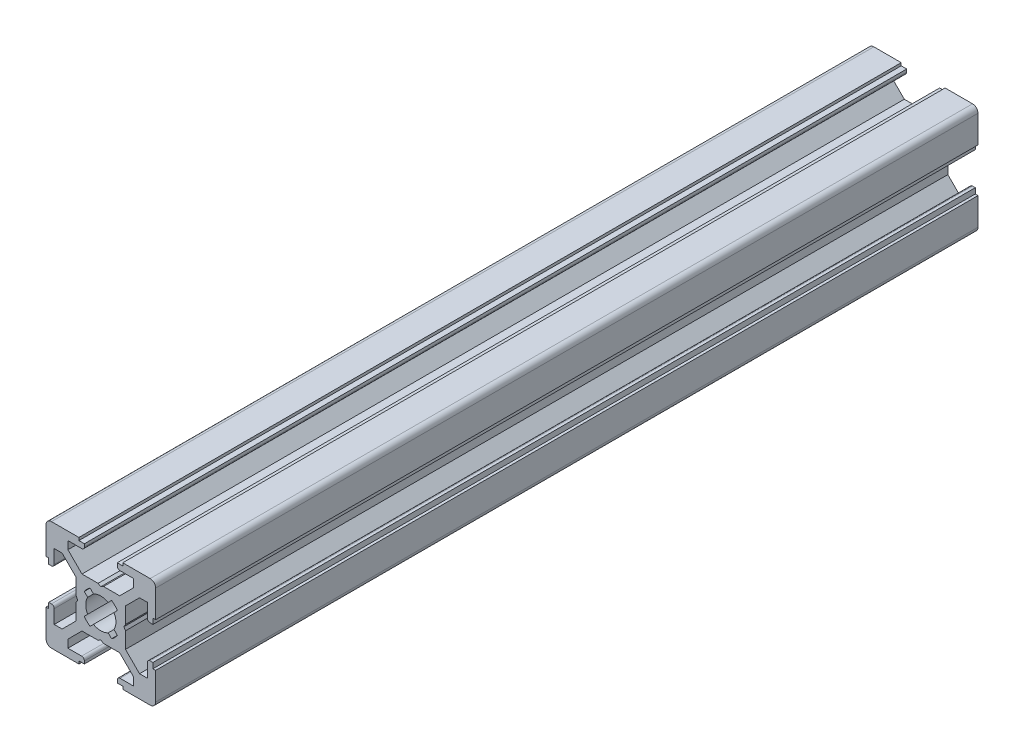
from build123d import *

# Parameters (mm, degrees)
EXTRUDE_1_DEPTH = 150


with BuildPart() as part:
    # Эскиз1 → Бобышка-Вытянуть1 (new body)
    with BuildSketch(Plane.XY):
        with BuildLine():
            Line((1, 20), (6, 20))
            Line((6, 20), (6, 19.5))
            Line((6, 19.5), (7, 19.5))
            Line((7, 19.5), (7, 19))
            ThreePointArc((7, 19), (6.853553391, 18.646446609), (6.5, 18.5))
            Line((6.5, 18.5), (4, 18.5))
            Line((4, 18.5), (4, 17.060660172))
            Line((4, 17.060660172), (6.560660172, 14.5))
            Line((6.560660172, 14.5), (9.5, 14.5))
            Line((9.5, 14.5), (10, 14.211324865))
            Line((10, 14.211324865), (10.5, 14.5))
            Line((10.5, 14.5), (13.439339828, 14.5))
            Line((13.439339828, 14.5), (16, 17.060660172))
            Line((16, 17.060660172), (16, 18.5))
            Line((16, 18.5), (13.5, 18.5))
            ThreePointArc((13.5, 18.5), (13.146446609, 18.646446609), (13, 19))
            Line((13, 19), (13, 19.5))
            Line((13, 19.5), (14, 19.5))
            Line((14, 19.5), (14, 20))
            Line((14, 20), (19, 20))
            ThreePointArc((19, 20), (19.707106781, 19.707106781), (20, 19))
            Line((20, 19), (20, 14))
            Line((20, 14), (19.5, 14))
            Line((19.5, 14), (19.5, 13))
            Line((19.5, 13), (19, 13))
            ThreePointArc((19, 13), (18.646446609, 13.146446609), (18.5, 13.5))
            Line((18.5, 13.5), (18.5, 16))
            Line((18.5, 16), (17.060660172, 16))
            Line((17.060660172, 16), (14.5, 13.439339828))
            Line((14.5, 13.439339828), (14.5, 10.5))
            Line((14.5, 10.5), (14.211324865, 10))
            Line((14.211324865, 10), (14.5, 9.5))
            Line((14.5, 9.5), (14.5, 6.560660172))
            Line((14.5, 6.560660172), (17.060660172, 4))
            Line((17.060660172, 4), (18.5, 4))
            Line((18.5, 4), (18.5, 6.5))
            ThreePointArc((18.5, 6.5), (18.646446609, 6.853553391), (19, 7))
            Line((19, 7), (19.5, 7))
            Line((19.5, 7), (19.5, 6))
            Line((19.5, 6), (20, 6))
            Line((20, 6), (20, 1))
            ThreePointArc((20, 1), (19.707106781, 0.292893219), (19, 0))
            Line((19, 0), (14, 0))
            Line((14, 0), (14, 0.5))
            Line((14, 0.5), (13, 0.5))
            Line((13, 0.5), (13, 1))
            ThreePointArc((13, 1), (13.146446609, 1.353553391), (13.5, 1.5))
            Line((13.5, 1.5), (16, 1.5))
            Line((16, 1.5), (16, 2.939339828))
            Line((16, 2.939339828), (13.439339828, 5.5))
            Line((13.439339828, 5.5), (10.5, 5.5))
            Line((10.5, 5.5), (10, 5.788675135))
            Line((10, 5.788675135), (9.5, 5.5))
            Line((9.5, 5.5), (6.560660172, 5.5))
            Line((6.560660172, 5.5), (4, 2.939339828))
            Line((4, 2.939339828), (4, 1.5))
            Line((4, 1.5), (6.5, 1.5))
            ThreePointArc((6.5, 1.5), (6.853553391, 1.353553391), (7, 1))
            Line((7, 1), (7, 0.5))
            Line((7, 0.5), (6, 0.5))
            Line((6, 0.5), (6, 0))
            Line((6, 0), (1, 0))
            ThreePointArc((1, 0), (0.292893219, 0.292893219), (0, 1))
            Line((0, 1), (0, 6))
            Line((0, 6), (0.5, 6))
            Line((0.5, 6), (0.5, 7))
            Line((0.5, 7), (1, 7))
            ThreePointArc((1, 7), (1.353553391, 6.853553391), (1.5, 6.5))
            Line((1.5, 6.5), (1.5, 4))
            Line((1.5, 4), (2.939339828, 4))
            Line((2.939339828, 4), (5.5, 6.560660172))
            Line((5.5, 6.560660172), (5.5, 9.5))
            Line((5.5, 9.5), (5.788675135, 10))
            Line((5.788675135, 10), (5.5, 10.5))
            Line((5.5, 10.5), (5.5, 13.439339828))
            Line((5.5, 13.439339828), (2.939339828, 16))
            Line((2.939339828, 16), (1.5, 16))
            Line((1.5, 16), (1.5, 13.5))
            ThreePointArc((1.5, 13.5), (1.353553391, 13.146446609), (1, 13))
            Line((1, 13), (0.5, 13))
            Line((0.5, 13), (0.5, 14))
            Line((0.5, 14), (0, 14))
            Line((0, 14), (0, 19))
            ThreePointArc((0, 19), (0.292893219, 19.707106781), (1, 20))
        make_face()
        with BuildLine():
            Line((6.979941013, 11.959398815), (7.598841221, 11.340498607))
            ThreePointArc((7.598841221, 11.340498607), (7.338638822, 10.692572508), (7.25, 10))
            ThreePointArc((7.25, 10), (7.338638822, 9.307427492), (7.598841221, 8.659501393))
            Line((7.598841221, 8.659501393), (6.979941013, 8.040601185))
            ThreePointArc((6.979941013, 8.040601185), (7.454415588, 7.454415588), (8.040601185, 6.979941013))
            Line((8.040601185, 6.979941013), (8.659501393, 7.598841221))
            ThreePointArc((8.659501393, 7.598841221), (9.307427492, 7.338638822), (10, 7.25))
            ThreePointArc((10, 7.25), (10.692572508, 7.338638822), (11.340498607, 7.598841221))
            Line((11.340498607, 7.598841221), (11.959398815, 6.979941013))
            ThreePointArc((11.959398815, 6.979941013), (12.545584412, 7.454415588), (13.020058987, 8.040601185))
            Line((13.020058987, 8.040601185), (12.401158779, 8.659501393))
            ThreePointArc((12.401158779, 8.659501393), (12.661361178, 9.307427492), (12.75, 10))
            ThreePointArc((12.75, 10), (12.661361178, 10.692572508), (12.401158779, 11.340498607))
            Line((12.401158779, 11.340498607), (13.020058987, 11.959398815))
            ThreePointArc((13.020058987, 11.959398815), (12.545584412, 12.545584412), (11.959398815, 13.020058987))
            Line((11.959398815, 13.020058987), (11.340498607, 12.401158779))
            ThreePointArc((11.340498607, 12.401158779), (10.692572508, 12.661361178), (10, 12.75))
            ThreePointArc((10, 12.75), (9.307427492, 12.661361178), (8.659501393, 12.401158779))
            Line((8.659501393, 12.401158779), (8.040601185, 13.020058987))
            ThreePointArc((8.040601185, 13.020058987), (7.454415588, 12.545584412), (6.979941013, 11.959398815))
        make_face(mode=Mode.SUBTRACT)
    extrude(amount=EXTRUDE_1_DEPTH)


solid = part.part
